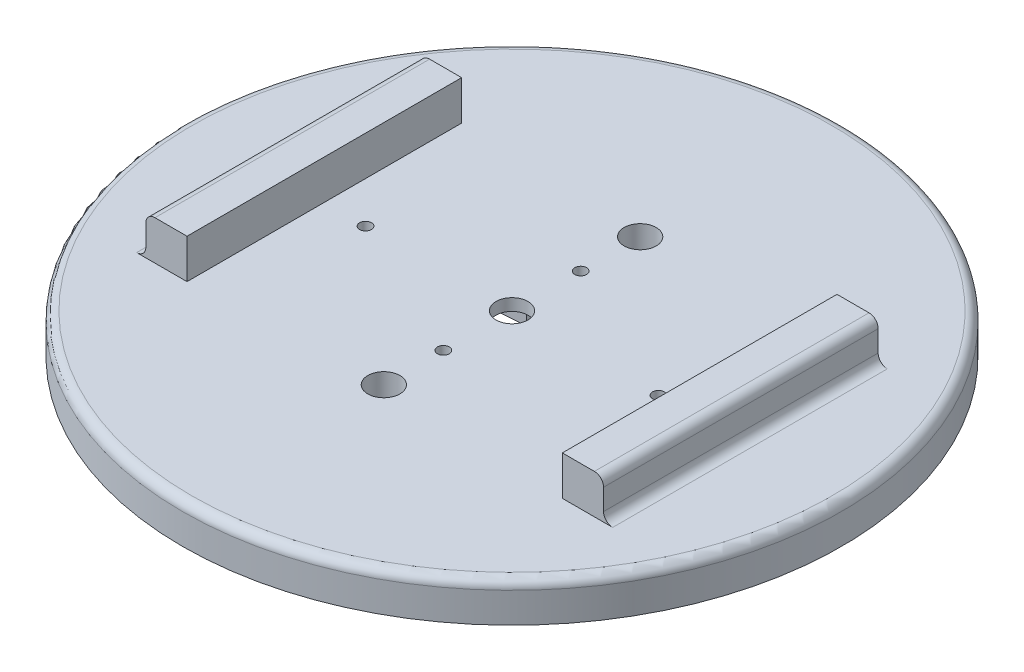
from build123d import *

# Parameters (mm, degrees)
CROQUIS1_R              = 36
CROQUIS1_R_2            = 1.75
SALIENTE_EXTRUIR1_DEPTH = 4.3
CROQUIS2_W              = 4.5
CROQUIS2_H              = 30
SALIENTE_EXTRUIR2_DEPTH = 4.3
REDONDEO1_R             = 1
CORTAR_EXTRUIR1_DEPTH   = 3
CROQUIS4_R              = 1.75
CORTAR_EXTRUIR2_DEPTH   = 10
CROQUIS5_R              = 0.65
CORTAR_EXTRUIR3_DEPTH   = 10


with BuildPart() as part:
    # Croquis1 → Saliente-Extruir1 (new body)
    with BuildSketch(Plane(origin=(0, 0, 0), x_dir=(1, 0, 0), z_dir=(0, 1, 0))):
        with Locations(Location((0, 0, 0), (0, 0, 90))):
            Circle(CROQUIS1_R)
        with Locations(Location((0, 14, 0), (0, 0, 90))):
            Circle(CROQUIS1_R_2, mode=Mode.SUBTRACT)
        with Locations(Location((0, -14, 0), (0, 0, 90))):
            Circle(CROQUIS1_R_2, mode=Mode.SUBTRACT)
    extrude(amount=SALIENTE_EXTRUIR1_DEPTH)

    # Croquis2 → Saliente-Extruir2 (add)
    with BuildSketch(Plane(origin=(0, 4.3, 0), x_dir=(1, 0, 0), z_dir=(0, 1, 0))):
        with Locations((22.75, 0)):
            Rectangle(CROQUIS2_W, CROQUIS2_H)
        with Locations((-22.75, 0)):
            Rectangle(CROQUIS2_W, CROQUIS2_H)
    extrude(amount=SALIENTE_EXTRUIR2_DEPTH)

    # Redondeo1
    redondeo1_edges = [part.edges().sort_by_distance(p)[0] for p in [
        (25, 4.3, 0),
        (25, 8.6, 0),
        (-25, 4.3, 0),
        (-25, 8.6, 0),
        (0, 4.3, 36),
    ]]
    fillet(redondeo1_edges, radius=REDONDEO1_R)

    # Croquis3 → Cortar-Extruir1 (cut)
    with BuildSketch(Plane.XZ):
        with BuildLine():
            Line((2.1, 3.659676792), (16.8, 2.5))
            ThreePointArc((16.8, 2.5), (19.3, 0), (16.8, -2.5))
            Line((16.8, -2.5), (2.1, -3.659676792))
            Line((2.1, -3.659676792), (2.1, -7.65))
            ThreePointArc((2.1, -7.65), (0, -9.75), (-2.1, -7.65))
            Line((-2.1, -7.65), (-2.1, -3.659676792))
            Line((-2.1, -3.659676792), (-16.8, -2.5))
            ThreePointArc((-16.8, -2.5), (-19.3, 0), (-16.8, 2.5))
            Line((-16.8, 2.5), (-2.1, 3.659676792))
            Line((-2.1, 3.659676792), (-2.1, 7.65))
            ThreePointArc((-2.1, 7.65), (0, 9.75), (2.1, 7.65))
            Line((2.1, 7.65), (2.1, 3.659676792))
        make_face()
    extrude(amount=-CORTAR_EXTRUIR1_DEPTH, mode=Mode.SUBTRACT)

    # Croquis4 → Cortar-Extruir2 (cut)
    with BuildSketch(Plane.XZ):
        with Locations(Location((0, 0, 0), (0, 0, 270))):
            Circle(CROQUIS4_R)
    extrude(amount=-CORTAR_EXTRUIR2_DEPTH, mode=Mode.SUBTRACT)

    # Croquis5 → Cortar-Extruir3 (cut)
    with BuildSketch(Plane.XZ):
        with Locations(Location((16, 0, 0), (0, 0, 270))):
            Circle(CROQUIS5_R)
        with Locations(Location((-16, 0, 0), (0, 0, 270))):
            Circle(CROQUIS5_R)
        with Locations(Location((0, 7.5, 0), (0, 0, 270))):
            Circle(CROQUIS5_R)
        with Locations(Location((0, -7.5, 0), (0, 0, 270))):
            Circle(CROQUIS5_R)
    extrude(amount=-CORTAR_EXTRUIR3_DEPTH, mode=Mode.SUBTRACT)


solid = part.part
